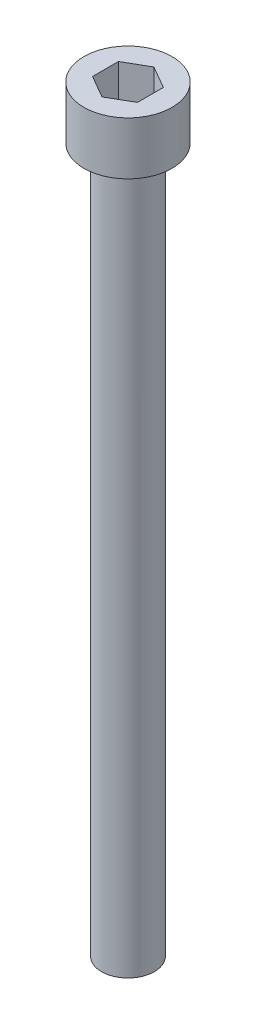
from build123d import *

# Parameters (mm, degrees)
SKETCH_1_R      = 5
EXTRUDE_1_DEPTH = 6
SKETCH_2_R      = 3
EXTRUDE_2_DEPTH = 80


with BuildPart() as part:
    # Эскиз1 → Вытянуть1 (new body)
    with BuildSketch(Plane(origin=(0, 0, 0), x_dir=(1, 0, 0), z_dir=(0, 1, 0))):
        with Locations(Location((0, 0, 0), (0, 0, 270))):
            Circle(SKETCH_1_R)
        Polygon((0, -2.944486373), (2.55, -1.472243186), (2.55, 1.472243186), (0, 2.944486373), (-2.55, 1.472243186), (-2.55, -1.472243186), align=None, mode=Mode.SUBTRACT)
    extrude(amount=EXTRUDE_1_DEPTH)

    # Эскиз2 → Вытянуть2 (add)
    with BuildSketch(Plane.XZ):
        with Locations(Location((0, 0, 0), (0, 0, 90))):
            Circle(SKETCH_2_R)
    extrude(amount=EXTRUDE_2_DEPTH)


solid = part.part
